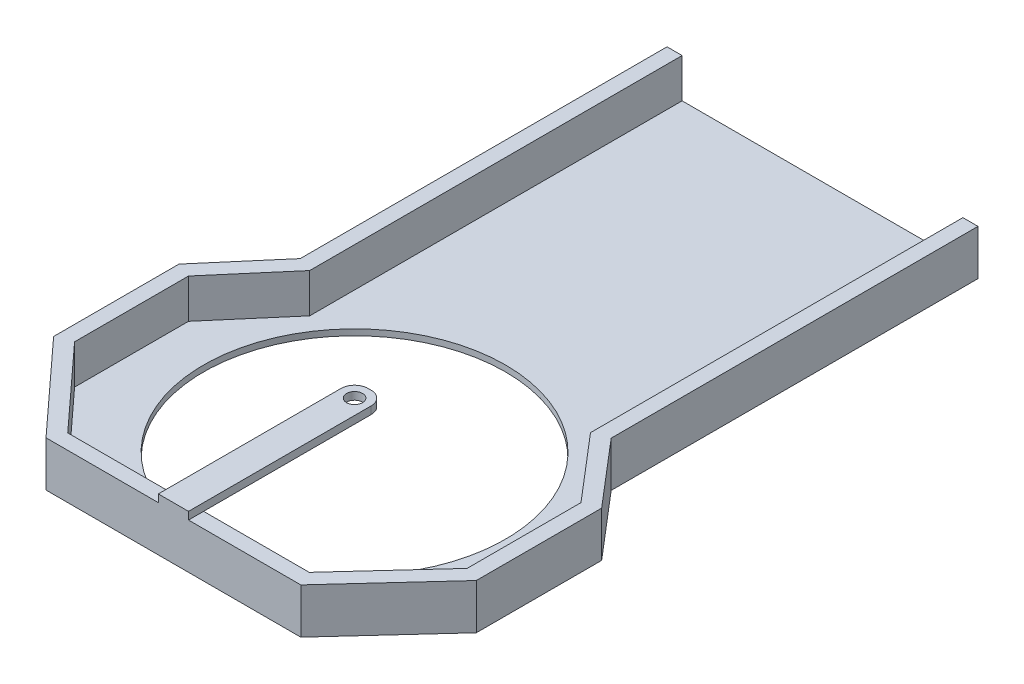
from build123d import *

# Parameters (mm, degrees)
BOSS_EXTRUDE1_DEPTH = 2
EXTRUDE_THIN3_DEPTH = 15
SKETCH3_W           = 93
SKETCH3_H           = 13
CUT_EXTRUDE1_DEPTH  = 5
SKETCH5_R           = 50
CUT_EXTRUDE2_DEPTH  = 2
BOSS_EXTRUDE2_DEPTH = 2.5
SKETCH4_3_R         = 2.65
CUT_EXTRUDE3_DEPTH  = 2.5


with BuildPart() as part:
    # Sketch1 → Boss-Extrude1 (new body)
    with BuildSketch(Plane(origin=(0, 0, 0), x_dir=(1, 0, 0), z_dir=(0, 1, 0))):
        Polygon((-46.5, 140), (46.5, 140), (46.5, 21.653994317), (65, 0), (65, -37.732612768), (40, -65), (-40, -65), (-65, -37.732612768), (-65, 0), (-46.5, 21.653994317), align=None)
    extrude(amount=BOSS_EXTRUDE1_DEPTH)

    # Sketch1<6> → Extrude-Thin3 (add)
    with BuildSketch(Plane(origin=(0, 0, 0), x_dir=(1, 0, 0), z_dir=(0, 1, 0))):
        Polygon((-51.5, 145), (51.5, 145), (51.5, 23.49902712), (70, 1.845032803), (70, -39.677811978), (42.199217545, -70), (-42.199217545, -70), (-70, -39.677811978), (-70, 1.845032803), (-51.5, 23.49902712), align=None)
        Polygon((-46.5, 140), (46.5, 140), (46.5, 21.653994317), (65, 0), (65, -37.732612768), (40, -65), (-40, -65), (-65, -37.732612768), (-65, 0), (-46.5, 21.653994317), align=None, mode=Mode.SUBTRACT)
    extrude(amount=EXTRUDE_THIN3_DEPTH)

    # Sketch3 → Cut-Extrude1 (cut)
    with BuildSketch(Plane.XY.offset(-140)):
        with Locations((0, 8.5)):
            Rectangle(SKETCH3_W, SKETCH3_H)
    extrude(amount=-CUT_EXTRUDE1_DEPTH, mode=Mode.SUBTRACT)

    # Sketch5 → Cut-Extrude2 (cut)
    with BuildSketch(Plane(origin=(0, 2, 0), x_dir=(1, 0, 0), z_dir=(0, 1, 0))):
        with Locations(Location((0, -10, 0), (0, 0, 270))):
            Circle(SKETCH5_R)
    extrude(amount=-CUT_EXTRUDE2_DEPTH, mode=Mode.SUBTRACT)

    # Sketch4 → Boss-Extrude2 (add)
    with BuildSketch(Plane(origin=(0, 15, 0), x_dir=(1, 0, 0), z_dir=(0, 1, 0))):
        with BuildLine():
            Line((-0.5, -5), (0.5, -5))
            ThreePointArc((0.5, -5), (3.681980515, -6.318019485), (5, -9.5))
            Line((5, -9.5), (5, -70))
            Line((5, -70), (-5, -70))
            Line((-5, -70), (-5, -9.5))
            ThreePointArc((-5, -9.5), (-3.681980515, -6.318019485), (-0.5, -5))
        make_face()
    extrude(amount=BOSS_EXTRUDE2_DEPTH)

    # Sketch4<3> → Cut-Extrude3 (cut)
    with BuildSketch(Plane(origin=(0, 15, 0), x_dir=(1, 0, 0), z_dir=(0, 1, 0))):
        with Locations(Location((0, -10, 0), (0, 0, 270))):
            Circle(SKETCH4_3_R)
    extrude(amount=CUT_EXTRUDE3_DEPTH, mode=Mode.SUBTRACT)


solid = part.part
